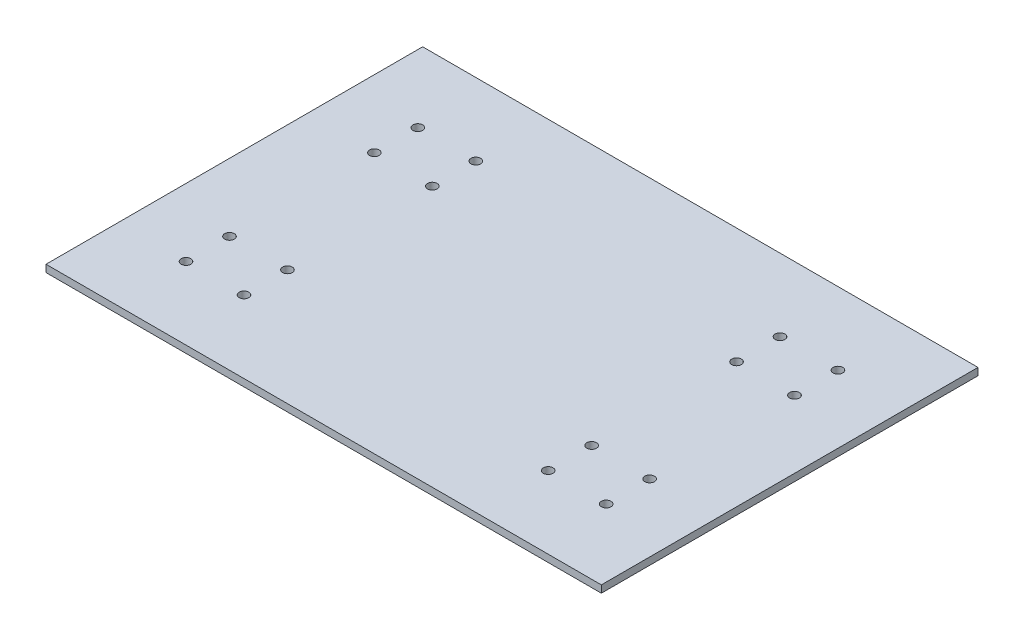
from build123d import *

# Parameters (mm, degrees)
SKETCH1_W           = 230
SKETCH1_H           = 156
BOSS_EXTRUDE1_DEPTH = 3
SKETCH2_R           = 2
CUT_EXTRUDE1_DEPTH  = 139.989208214


with BuildPart() as part:
    # Sketch1 → Boss-Extrude1 (new body)
    with BuildSketch(Plane(origin=(0, 0, 0), x_dir=(1, 0, 0), z_dir=(0, 1, 0))):
        Rectangle(SKETCH1_W, SKETCH1_H)
    extrude(amount=BOSS_EXTRUDE1_DEPTH)

    # Sketch2 → Cut-Extrude1 (cut, through all)
    with BuildSketch(Plane(origin=(0, 3, 0), x_dir=(1, 0, 0), z_dir=(0, 1, 0))):
        with Locations(Location((63, 48, 0), (0, 0, 270))):
            Circle(SKETCH2_R)
        with Locations(Location((87, 48, 0), (0, 0, 270))):
            Circle(SKETCH2_R)
        with Locations(Location((87, 30, 0), (0, 0, 270))):
            Circle(SKETCH2_R)
        with Locations(Location((63, 30, 0), (0, 0, 270))):
            Circle(SKETCH2_R)
        with Locations(Location((-63, 30, 0), (0, 0, 90))):
            Circle(SKETCH2_R)
        with Locations(Location((-87, 30, 0), (0, 0, 90))):
            Circle(SKETCH2_R)
        with Locations(Location((-87, 48, 0), (0, 0, 90))):
            Circle(SKETCH2_R)
        with Locations(Location((-63, 48, 0), (0, 0, 90))):
            Circle(SKETCH2_R)
        with Locations(Location((-63, -48, 0), (0, 0, 270))):
            Circle(SKETCH2_R)
        with Locations(Location((-87, -48, 0), (0, 0, 270))):
            Circle(SKETCH2_R)
        with Locations(Location((-87, -30, 0), (0, 0, 270))):
            Circle(SKETCH2_R)
        with Locations(Location((-63, -30, 0), (0, 0, 270))):
            Circle(SKETCH2_R)
        with Locations(Location((63, -30, 0), (0, 0, 90))):
            Circle(SKETCH2_R)
        with Locations(Location((87, -30, 0), (0, 0, 90))):
            Circle(SKETCH2_R)
        with Locations(Location((87, -48, 0), (0, 0, 90))):
            Circle(SKETCH2_R)
        with Locations(Location((63, -48, 0), (0, 0, 90))):
            Circle(SKETCH2_R)
    extrude(amount=-CUT_EXTRUDE1_DEPTH, mode=Mode.SUBTRACT)


solid = part.part
